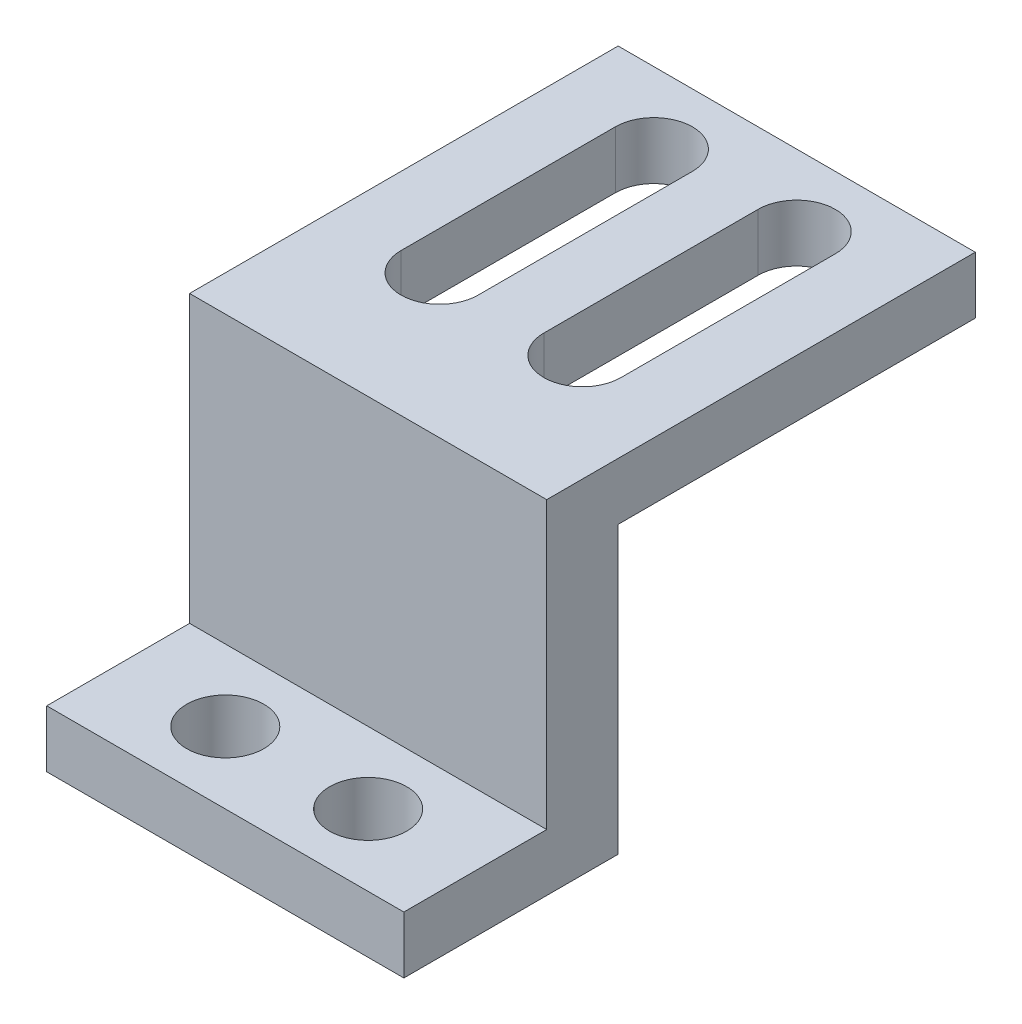
from build123d import *

# Parameters (mm, degrees)
BOSS_EXTRUDE1_DEPTH     = 15.875
CUT_EXTRUDE1_DEPTH      = 59.973007597
CUT_EXTRUDE1_DEPTH_BACK = 59.973007597
SKETCH2_R               = 3.429


with BuildPart() as part:
    # Sketch1 → Boss-Extrude1 (new, symmetric)
    with BuildSketch(Plane(origin=(0, 0, 0), x_dir=(0, 0, -1), z_dir=(1, 0, 0))):
        Polygon((0, 0), (19.05, 0), (19.05, 25.4), (31.75, 25.4), (50.8, 25.4), (50.8, 30.48), (31.75, 30.48), (12.7, 30.48), (12.7, 5.08), (0, 5.08), align=None)
    extrude(amount=BOSS_EXTRUDE1_DEPTH, both=True)

    # Sketch2 → Cut-Extrude1 (cut, two sides: drawn at the far end of the back side and taken through both)
    with BuildSketch(Plane(origin=(0, 5.08, 0), x_dir=(1, 0, 0), z_dir=(0, 1, 0)).offset(-CUT_EXTRUDE1_DEPTH_BACK)):
        with Locations(Location((-6.35, 6.35, 0), (0, 0, 270))):
            Circle(SKETCH2_R)
        with Locations(Location((6.35, 6.35, 0), (0, 0, 270))):
            Circle(SKETCH2_R)
        with BuildLine():
            Line((-2.921, 44.45), (-2.921, 25.4))
            ThreePointArc((-2.921, 25.4), (-6.35, 21.971), (-9.779, 25.4))
            Line((-9.779, 25.4), (-9.779, 44.45))
            ThreePointArc((-9.779, 44.45), (-6.35, 47.879), (-2.921, 44.45))
        make_face()
        with BuildLine():
            Line((9.779, 44.45), (9.779, 25.4))
            ThreePointArc((9.779, 25.4), (6.35, 21.971), (2.921, 25.4))
            Line((2.921, 25.4), (2.921, 44.45))
            ThreePointArc((2.921, 44.45), (6.35, 47.879), (9.779, 44.45))
        make_face()
    extrude(amount=CUT_EXTRUDE1_DEPTH + CUT_EXTRUDE1_DEPTH_BACK, mode=Mode.SUBTRACT)


solid = part.part
